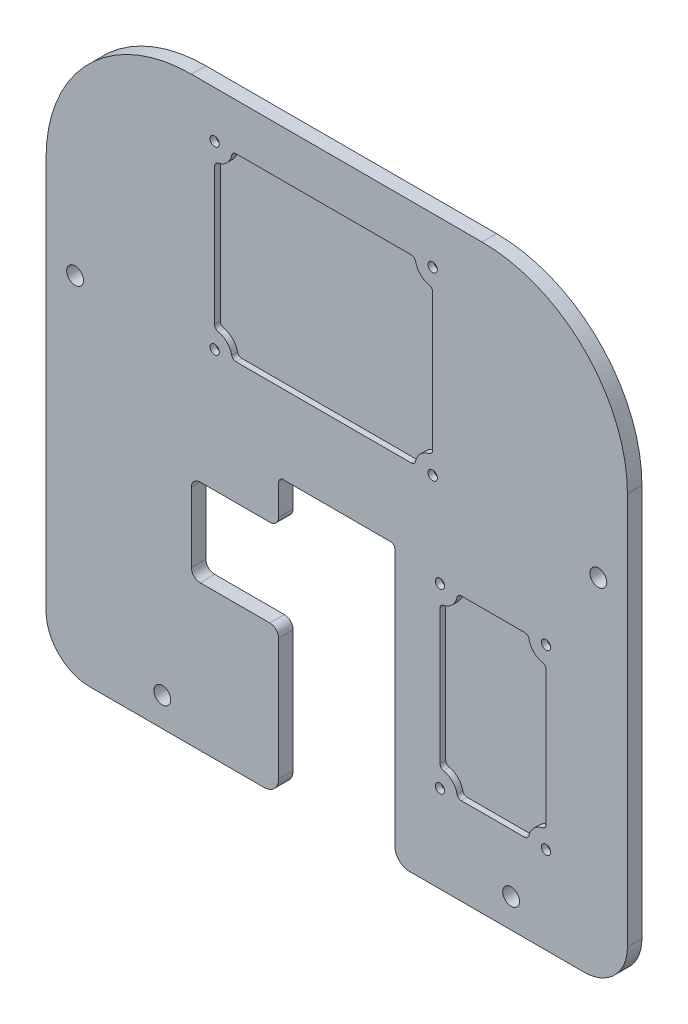
from build123d import *

# Parameters (mm, degrees)
SKETCH_1_W          = 200
SKETCH_1_H          = 200
EXTRUDE_1_DEPTH     = 5
SKETCH_2_W          = 40
SKETCH_2_H          = 95
CUT_EXTRUDE_1_DEPTH = 149.744747806
FILLET_1_R          = 50
FILLET_2_R          = 1.5
SKETCH_3_W          = 30
SKETCH_3_H          = 30
CUT_EXTRUDE_2_DEPTH = 10
FILLET_3_R          = 3
M3X0_5_2_D          = 2.5
M3X0_5_1_D          = 2.5
FILLET_4_R          = 15
FILLET_5_R          = 5
HOLE_WIZARD_M5_1_D  = 5.8
SKETCH_4_R          = 1.6
CUT_EXTRUDE_3_DEPTH = 2
SKETCH_7_R          = 1.6
CUT_EXTRUDE_4_DEPTH = 2


with BuildPart() as part:
    # ｽｹｯﾁ1 → ﾎﾞｽ - 押し出し1 (new body)
    with BuildSketch(Plane.XY):
        with Locations((0, 10)):
            Rectangle(SKETCH_1_W, SKETCH_1_H)
    extrude(amount=EXTRUDE_1_DEPTH)

    # ｽｹｯﾁ2 → ｶｯﾄ - 押し出し1 (cut, through all)
    with BuildSketch(Plane.XY.offset(5)):
        with Locations((0, -42.5)):
            Rectangle(SKETCH_2_W, SKETCH_2_H)
    extrude(amount=-CUT_EXTRUDE_1_DEPTH, mode=Mode.SUBTRACT)

    # ﾌｨﾚｯﾄ1
    fillet_1_edges = [part.edges().sort_by_distance(p)[0] for p in [
        (-100, 110, 2.5),
        (100, 110, 2.5),
    ]]
    fillet(fillet_1_edges, radius=FILLET_1_R)

    # ﾌｨﾚｯﾄ2
    fillet_2_edges = [part.edges().sort_by_distance(p)[0] for p in [
        (-20, 5, 2.5),
        (20, 5, 2.5),
    ]]
    fillet(fillet_2_edges, radius=FILLET_2_R)

    # ｽｹｯﾁ3 → ｶｯﾄ - 押し出し2 (cut)
    with BuildSketch(Plane(origin=(0, 0, 0), x_dir=(-1, 0, 0), z_dir=(0, 0, -1))):
        with Locations((35, -25)):
            Rectangle(SKETCH_3_W, SKETCH_3_H)
    extrude(amount=-CUT_EXTRUDE_2_DEPTH, mode=Mode.SUBTRACT)

    # ﾌｨﾚｯﾄ3
    fillet_3_edges = [part.edges().sort_by_distance(p)[0] for p in [
        (-20, -40, 2.5),
        (-20, -10, 2.5),
        (-50, -10, 2.5),
        (-50, -40, 2.5),
    ]]
    fillet(fillet_3_edges, radius=FILLET_3_R)

    # M3x0.5 ねじ穴用ねじ下穴ﾄﾞﾘﾙ2 (through all)
    with Locations(Plane.XY.offset(5)):
        with Locations((-42, 94), (33, 94), (-42, 32), (33, 32)):
            Hole(M3X0_5_2_D / 2)

    # M3x0.5 ねじ穴用ねじ下穴ﾄﾞﾘﾙ1 (through all)
    with Locations(Plane.XY.offset(5)):
        with Locations((35.5, 1), (72, 1), (35.5, -60), (72, -60)):
            Hole(M3X0_5_1_D / 2)

    # ﾌｨﾚｯﾄ4
    fillet_4_edges = [part.edges().sort_by_distance(p)[0] for p in [
        (100, -90, 2.5),
        (-100, -90, 2.5),
    ]]
    fillet(fillet_4_edges, radius=FILLET_4_R)

    # ﾌｨﾚｯﾄ5
    fillet_5_edges = [part.edges().sort_by_distance(p)[0] for p in [
        (-20, -90, 2.5),
        (20, -90, 2.5),
    ]]
    fillet(fillet_5_edges, radius=FILLET_5_R)

    # M5 すきま穴1 (through all)
    with Locations(Plane(origin=(0, 0, 0), x_dir=(-1, 0, 0), z_dir=(0, 0, -1))):
        with Locations((-60, -80), (60, -80), (-90, 30), (90, 30)):
            Hole(HOLE_WIZARD_M5_1_D / 2)

    # ｽｹｯﾁ4 → ｶｯﾄ - 押し出し3 (cut)
    with BuildSketch(Plane.XY.offset(5)):
        with Locations((-42, 94)):
            Circle(SKETCH_4_R)
        with Locations((33, 94)):
            Circle(SKETCH_4_R)
        with Locations((-42, 32)):
            Circle(SKETCH_4_R)
        with Locations((33, 32)):
            Circle(SKETCH_4_R)
        with BuildLine():
            Line((-34.651530772, 94), (25.651530772, 94))
            ThreePointArc((25.651530772, 94), (26.60021407, 93.661895004), (27.121224617, 92.8))
            ThreePointArc((27.121224617, 92.8), (28.757359313, 89.757359313), (31.8, 88.121224617))
            ThreePointArc((31.8, 88.121224617), (32.661895004, 87.60021407), (33, 86.651530772))
            Line((33, 86.651530772), (33, 39.348469228))
            ThreePointArc((33, 39.348469228), (32.661895004, 38.39978593), (31.8, 37.878775383))
            ThreePointArc((31.8, 37.878775383), (28.757359313, 36.242640687), (27.121224617, 33.2))
            ThreePointArc((27.121224617, 33.2), (26.60021407, 32.338104996), (25.651530772, 32))
            Line((25.651530772, 32), (-34.651530772, 32))
            ThreePointArc((-34.651530772, 32), (-35.60021407, 32.338104996), (-36.121224617, 33.2))
            ThreePointArc((-36.121224617, 33.2), (-37.757359313, 36.242640687), (-40.8, 37.878775383))
            ThreePointArc((-40.8, 37.878775383), (-41.661895004, 38.39978593), (-42, 39.348469228))
            Line((-42, 39.348469228), (-42, 86.651530772))
            ThreePointArc((-42, 86.651530772), (-41.661895004, 87.60021407), (-40.8, 88.121224617))
            ThreePointArc((-40.8, 88.121224617), (-37.757359313, 89.757359313), (-36.121224617, 92.8))
            ThreePointArc((-36.121224617, 92.8), (-35.60021407, 93.661895004), (-34.651530772, 94))
        make_face()
    extrude(amount=-CUT_EXTRUDE_3_DEPTH, mode=Mode.SUBTRACT)

    # ｽｹｯﾁ7 → ｶｯﾄ - 押し出し4 (cut)
    with BuildSketch(Plane.XY.offset(5)):
        with Locations((35.5, 1)):
            Circle(SKETCH_7_R)
        with Locations((72, 1)):
            Circle(SKETCH_7_R)
        with Locations((35.5, -60)):
            Circle(SKETCH_7_R)
        with Locations((72, -60)):
            Circle(SKETCH_7_R)
        with BuildLine():
            Line((64.651530772, -60), (42.848469228, -60))
            ThreePointArc((42.848469228, -60), (41.89978593, -59.661895004), (41.378775383, -58.8))
            ThreePointArc((41.378775383, -58.8), (39.742640687, -55.757359313), (36.7, -54.121224617))
            ThreePointArc((36.7, -54.121224617), (35.838104996, -53.60021407), (35.5, -52.651530772))
            Line((35.5, -52.651530772), (35.5, -6.348469228))
            ThreePointArc((35.5, -6.348469228), (35.838104996, -5.39978593), (36.7, -4.878775383))
            ThreePointArc((36.7, -4.878775383), (39.742640687, -3.242640687), (41.378775383, -0.2))
            ThreePointArc((41.378775383, -0.2), (41.89978593, 0.661895004), (42.848469228, 1))
            Line((42.848469228, 1), (64.651530772, 1))
            ThreePointArc((64.651530772, 1), (65.60021407, 0.661895004), (66.121224617, -0.2))
            ThreePointArc((66.121224617, -0.2), (67.757359313, -3.242640687), (70.8, -4.878775383))
            ThreePointArc((70.8, -4.878775383), (71.661895004, -5.39978593), (72, -6.348469228))
            Line((72, -6.348469228), (72, -52.651530772))
            ThreePointArc((72, -52.651530772), (71.661895004, -53.60021407), (70.8, -54.121224617))
            ThreePointArc((70.8, -54.121224617), (67.757359313, -55.757359313), (66.121224617, -58.8))
            ThreePointArc((66.121224617, -58.8), (65.60021407, -59.661895004), (64.651530772, -60))
        make_face()
    extrude(amount=-CUT_EXTRUDE_4_DEPTH, mode=Mode.SUBTRACT)


solid = part.part
